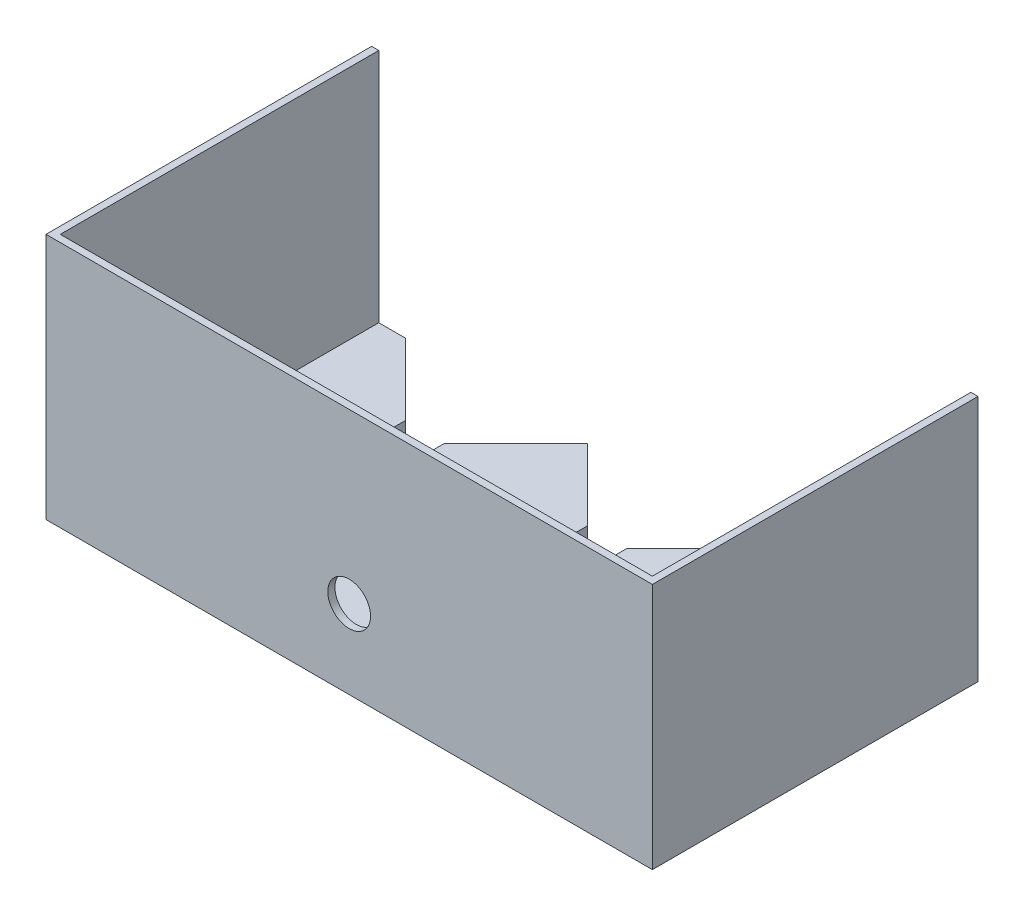
from build123d import *

# Parameters (mm, degrees)
BOSS_EXTRUDE5_DEPTH     = 10
BOSS_EXTRUDE6_DEPTH     = 210
CUT_EXTRUDE1_DEPTH      = 577.072414333
CUT_EXTRUDE1_DEPTH_BACK = 577.072414333
SKETCH6_R               = 19.05


with BuildPart() as part:
    # Sketch1 → Boss-Extrude5 (new body)
    with BuildSketch(Plane(origin=(0, 0, 0), x_dir=(1, 0, 0), z_dir=(0, 1, 0))):
        Polygon((-69.524052506, -40.777590524), (-69.524052506, 249.222409476), (-39.524052506, 249.222409476), (24.115557801, 185.58279917), (24.115557801, 105.58279917), (59.115557801, 105.58279917), (59.115557801, 185.58279917), (122.755168108, 249.222409476), (186.394778415, 185.58279917), (186.394778415, 105.58279917), (221.394778415, 105.58279917), (221.394778415, 185.58279917), (283.247626246, 247.435647001), (346.887236552, 183.796036694), (346.887236552, 105.58279917), (381.887236552, 105.58279917), (381.887236552, 185.58279917), (445.526846859, 249.222409476), (470.475947494, 249.222409476), (470.475947494, -40.777590524), align=None)
    extrude(amount=BOSS_EXTRUDE5_DEPTH)

    # Sketch5 → Boss-Extrude6 (add)
    with BuildSketch(Plane(origin=(0, 10, 0), x_dir=(1, 0, 0), z_dir=(0, 1, 0))):
        Polygon((-69.524052506, -40.777590524), (-69.524052506, 249.222409476), (-63.174052506, 249.222409476), (-63.174052506, -34.427590524), (464.125947494, -34.427590524), (464.125947494, 249.222409476), (470.475947494, 249.222409476), (470.475947494, -40.777590524), align=None)
    extrude(amount=BOSS_EXTRUDE6_DEPTH)

    # Sketch6 → Cut-Extrude1 (cut, two sides: drawn at the far end of the back side and taken through both)
    with BuildSketch(Plane.XY.offset(-CUT_EXTRUDE1_DEPTH_BACK)):
        with Locations((200.475947494, 70)):
            Circle(SKETCH6_R)
    extrude(amount=CUT_EXTRUDE1_DEPTH + CUT_EXTRUDE1_DEPTH_BACK, mode=Mode.SUBTRACT)


solid = part.part
